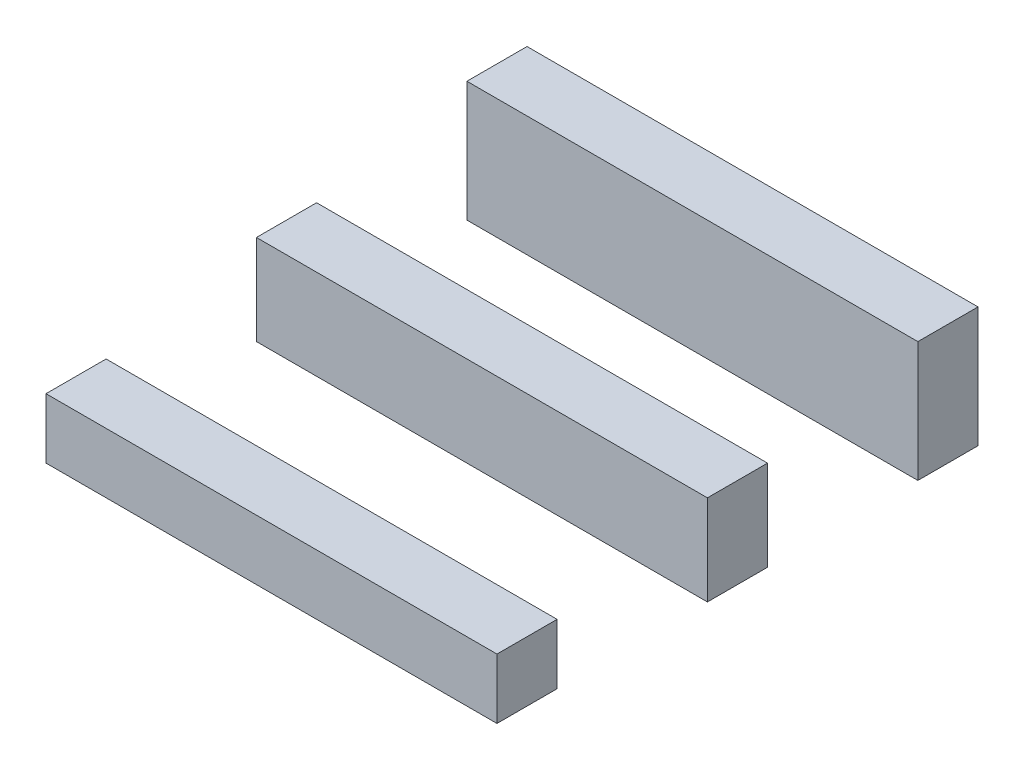
from build123d import *

# Parameters (mm, degrees)
SKETCH2_W           = 30
SKETCH2_H           = 4
BOSS_EXTRUDE1_DEPTH = 4
SKETCH3_W           = 30
SKETCH3_H           = 4
BOSS_EXTRUDE2_DEPTH = 6
SKETCH4_W           = 30
SKETCH4_H           = 4
BOSS_EXTRUDE3_DEPTH = 8


with BuildPart() as part:
    # Sketch2 → Boss-Extrude1 (new body)
    with BuildSketch(Plane(origin=(0, 1, 0), x_dir=(1, 0, 0), z_dir=(0, 1, 0))):
        with Locations((0, -14)):
            Rectangle(SKETCH2_W, SKETCH2_H)
    extrude(amount=BOSS_EXTRUDE1_DEPTH)


with BuildPart() as body_2:
    # Sketch3 → Boss-Extrude2 (new body)
    with BuildSketch(Plane(origin=(0, 1, 0), x_dir=(1, 0, 0), z_dir=(0, 1, 0))):
        Rectangle(SKETCH3_W, SKETCH3_H)
    extrude(amount=BOSS_EXTRUDE2_DEPTH)


with BuildPart() as body_3:
    # Sketch4 → Boss-Extrude3 (new body)
    with BuildSketch(Plane(origin=(0, 1, 0), x_dir=(1, 0, 0), z_dir=(0, 1, 0))):
        with Locations((0, 14)):
            Rectangle(SKETCH4_W, SKETCH4_H)
    extrude(amount=BOSS_EXTRUDE3_DEPTH)


solid = Compound([part.part, body_2.part, body_3.part])
